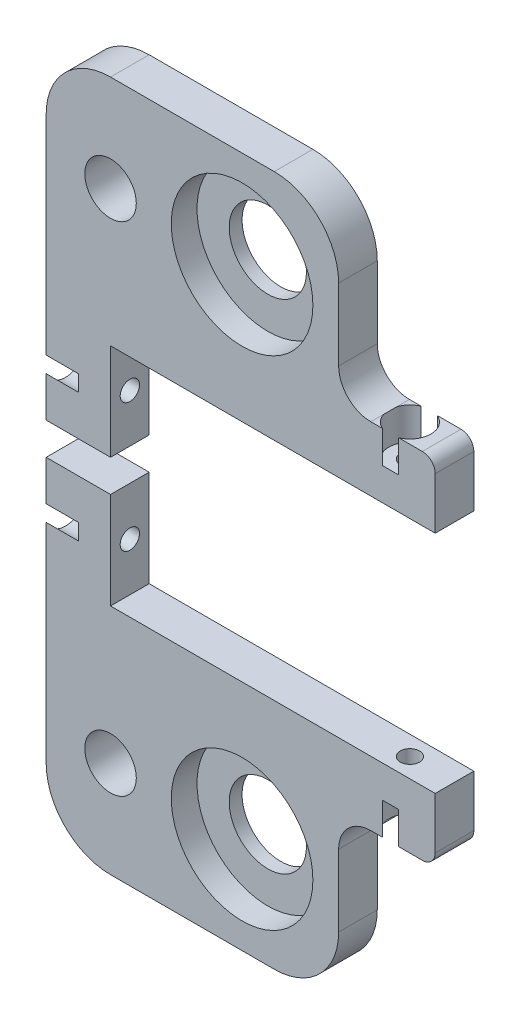
from build123d import *

# Parameters (mm, degrees)
CROQUIS1_R              = 4
CROQUIS1_R_2            = 6
SALIENTE_EXTRUIR2_DEPTH = 6
CROQUIS2_R              = 11
CORTAR_EXTRUIR1_DEPTH   = 4
CROQUIS3_R              = 1.5
CORTAR_EXTRUIR2_DEPTH   = 71.672536391
CROQUIS4_R              = 1.5
CORTAR_EXTRUIR3_DEPTH   = 63.337848856
CROQUIS5_R              = 3.25
CORTAR_EXTRUIR4_DEPTH   = 5
CROQUIS6_R              = 3.25
CORTAR_EXTRUIR5_DEPTH   = 5


with BuildPart() as part:
    # Croquis1 → Saliente-Extruir2 (new body)
    with BuildSketch(Plane.XY):
        with BuildLine():
            Line((-50.43, 0), (0, 0))
            Line((0, 0), (0, -8))
            ThreePointArc((0, -8), (-0.585786438, -9.414213562), (-2, -10))
            Line((-2, -10), (-10, -10))
            ThreePointArc((-10, -10), (-13.535533906, -11.464466094), (-15, -15))
            Line((-15, -15), (-15, -26.15))
            ThreePointArc((-15, -26.15), (-17.928932188, -33.221067812), (-25, -36.15))
            Line((-25, -36.15), (-50.43, -36.15))
            ThreePointArc((-50.43, -36.15), (-57.501067812, -33.221067812), (-60.43, -26.15))
            Line((-60.43, -26.15), (-60.43, 15))
            Line((-60.43, 15), (-50.43, 15))
            Line((-50.43, 15), (-50.43, 0))
        make_face()
        with Locations((-50.43, -21.15)):
            Circle(CROQUIS1_R, mode=Mode.SUBTRACT)
        with Locations((-30, -21.15)):
            Circle(CROQUIS1_R_2, mode=Mode.SUBTRACT)
    extrude(amount=SALIENTE_EXTRUIR2_DEPTH)

    # Croquis2 → Cortar-Extruir1 (cut)
    with BuildSketch(Plane.XY.offset(6)):
        with Locations((-30, -21.15)):
            Circle(CROQUIS2_R)
    extrude(amount=-CORTAR_EXTRUIR1_DEPTH, mode=Mode.SUBTRACT)

    # Croquis3 → Cortar-Extruir2 (cut, through all)
    with BuildSketch(Plane(origin=(0, 0, 0), x_dir=(-1, 0, 0), z_dir=(0, 1, 0))):
        with Locations(Location((6.93, 3, 0), (0, 0, 90))):
            Circle(CROQUIS3_R)
    extrude(amount=-CORTAR_EXTRUIR2_DEPTH, mode=Mode.SUBTRACT)

    # Croquis4 → Cortar-Extruir3 (cut, through all)
    with BuildSketch(Plane(origin=(-50.43, 0, 0), x_dir=(0, 0, -1), z_dir=(1, 0, 0))):
        with Locations((-3, 7.5)):
            Circle(CROQUIS4_R)
    extrude(amount=-CORTAR_EXTRUIR3_DEPTH, mode=Mode.SUBTRACT)

    # Croquis5 → Cortar-Extruir4 (cut)
    with BuildSketch(Plane.ZY.offset(60.43)):
        with Locations((3, 7.5)):
            Circle(CROQUIS5_R)
    extrude(amount=-CORTAR_EXTRUIR4_DEPTH, mode=Mode.SUBTRACT)

    # Croquis6 → Cortar-Extruir5 (cut)
    with BuildSketch(Plane.XZ.offset(10)):
        with Locations((-6.93, 3)):
            Circle(CROQUIS6_R)
    extrude(amount=-CORTAR_EXTRUIR5_DEPTH, mode=Mode.SUBTRACT)


with BuildPart() as body_2:
    # Simetría2: mirrored copy
    add(part.part.mirror(Plane.ZX.offset(17.5)))


solid = Compound([part.part, body_2.part])
